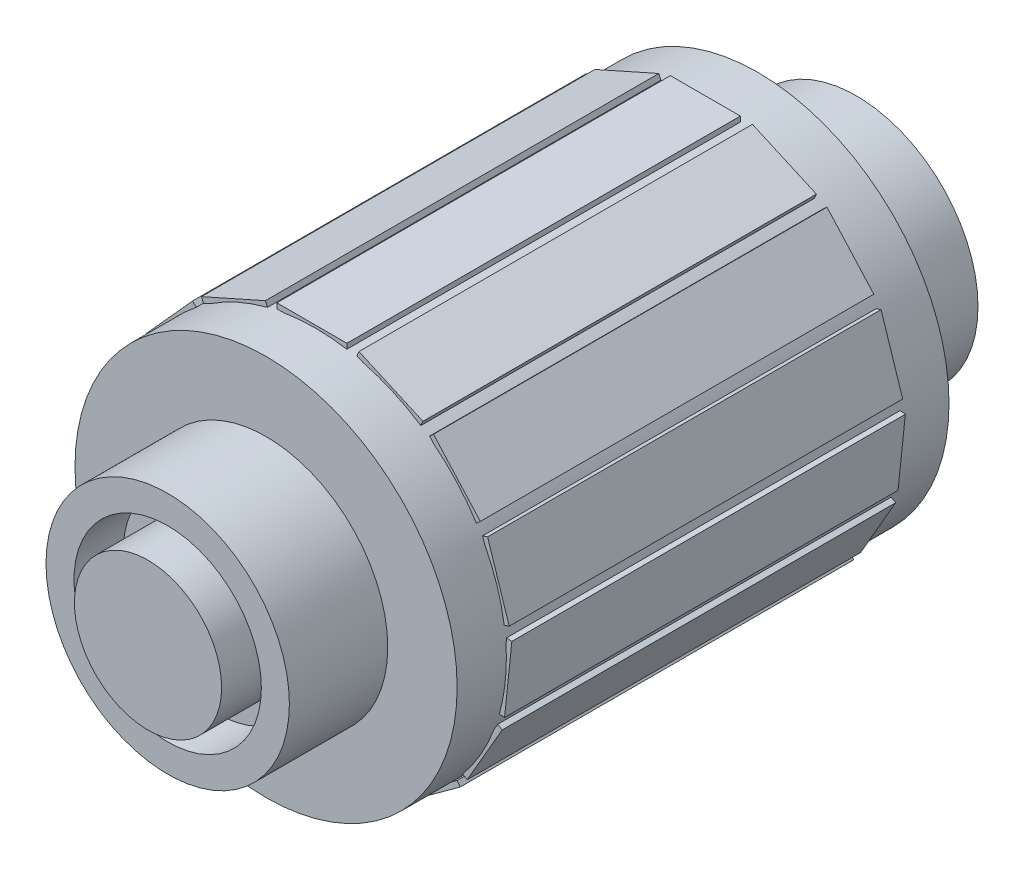
from build123d import *

# Parameters (mm, degrees)
SKETCH1_R           = 12.37
BOSS_EXTRUDE1_DEPTH = 10
SKETCH2_R           = 19.423188446
BOSS_EXTRUDE2_DEPTH = 50
SKETCH4_R           = 12.37
BOSS_EXTRUDE3_DEPTH = 10
BOSS_EXTRUDE4_START = -5
SKETCH5_W           = 7.115833501
SKETCH5_H           = 0.529627629
BOSS_EXTRUDE4_DEPTH = 40
CIRPATTERN1_COUNT   = 15
SKETCH6_R           = 9.521283716
CUT_EXTRUDE1_DEPTH  = 5
CUT_EXTRUDE2_START  = -5
SKETCH7_R           = 9.521283716
CUT_EXTRUDE2_DEPTH  = 5
SKETCH8_R           = 7.481646465
BOSS_EXTRUDE5_DEPTH = 7
BOSS_EXTRUDE6_START = 7
SKETCH9_R           = 7.481646465
BOSS_EXTRUDE6_DEPTH = 7


with BuildPart() as part:
    # Sketch1 → Boss-Extrude1 (new body)
    with BuildSketch(Plane.XY):
        Circle(SKETCH1_R)
    extrude(amount=BOSS_EXTRUDE1_DEPTH)

    # Sketch2 → Boss-Extrude2 (add)
    with BuildSketch(Plane.XY.offset(10)):
        Circle(SKETCH2_R)
    extrude(amount=BOSS_EXTRUDE2_DEPTH)

    # Sketch4 → Boss-Extrude3 (add)
    with BuildSketch(Plane.XY.offset(60)):
        Circle(SKETCH4_R)
    extrude(amount=BOSS_EXTRUDE3_DEPTH)

    # Sketch5 → Boss-Extrude4 (add)
    with BuildSketch(Plane.XY.offset(60).offset(BOSS_EXTRUDE4_START)):
        with Locations((-0.343381899, 19.42015289)):
            Rectangle(SKETCH5_W, SKETCH5_H)
    boss_extrude4 = extrude(amount=-BOSS_EXTRUDE4_DEPTH)

    # CirPattern1: Boss-Extrude4 ×15 about axis
    cirpattern1_axis = Axis((0, 0, 0), (0, 0, -1))
    for i in range(1, CIRPATTERN1_COUNT):
        add(boss_extrude4.rotate(cirpattern1_axis, i * 360 / CIRPATTERN1_COUNT))

    # Sketch6 → Cut-Extrude1 (cut)
    with BuildSketch(Plane.XY.offset(70)):
        Circle(SKETCH6_R)
    extrude(amount=-CUT_EXTRUDE1_DEPTH, mode=Mode.SUBTRACT)

    # Sketch7 → Cut-Extrude2 (cut)
    with BuildSketch(Plane(origin=(0, 0, 0), x_dir=(-1, 0, 0), z_dir=(0, 0, -1)).offset(CUT_EXTRUDE2_START)):
        Circle(SKETCH7_R)
    extrude(amount=CUT_EXTRUDE2_DEPTH, mode=Mode.SUBTRACT)

    # Sketch8 → Boss-Extrude5 (add)
    with BuildSketch(Plane(origin=(0, 0, 5), x_dir=(-1, 0, 0), z_dir=(0, 0, -1))):
        Circle(SKETCH8_R)
    extrude(amount=BOSS_EXTRUDE5_DEPTH)

    # Sketch9 → Boss-Extrude6 (add)
    with BuildSketch(Plane.XY.offset(65).offset(BOSS_EXTRUDE6_START)):
        Circle(SKETCH9_R)
    extrude(amount=-BOSS_EXTRUDE6_DEPTH)


solid = part.part
